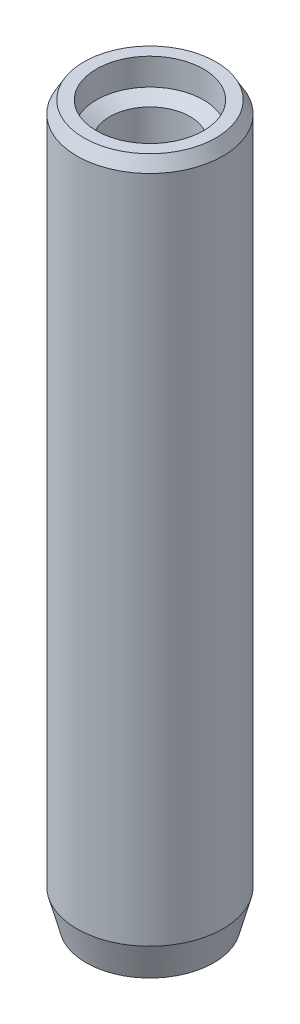
from build123d import *


with BuildPart() as part:
    # Sketch1 → Revolve1 (revolve)
    with BuildSketch(Plane.XY, mode=Mode.PRIVATE) as revolve1_sk:
        with BuildLine():
            Line((2.711324865, 30), (2.2, 30))
            Line((2.2, 30), (2.2, 28.9))
            Line((2.2, 28.9), (1.65, 28.582457352))
            Line((1.65, 28.582457352), (1.65, 20))
            Line((1.65, 20), (0, 19.008579979))
            Line((0, 19.008579979), (0, 0))
            ThreePointArc((0, 0), (1.347576341, 0.153288274), (2.626296799, 0.605320665))
            Line((2.626296799, 0.605320665), (3, 2))
            Line((3, 2), (3, 29.5))
            Line((3, 29.5), (2.711324865, 30))
        make_face()
    revolve(revolve1_sk.sketch.rotate(Axis((0, 30, 0), (0, -1, 0)), 90), axis=Axis((0, 30, 0), (0, -1, 0)))


solid = part.part
